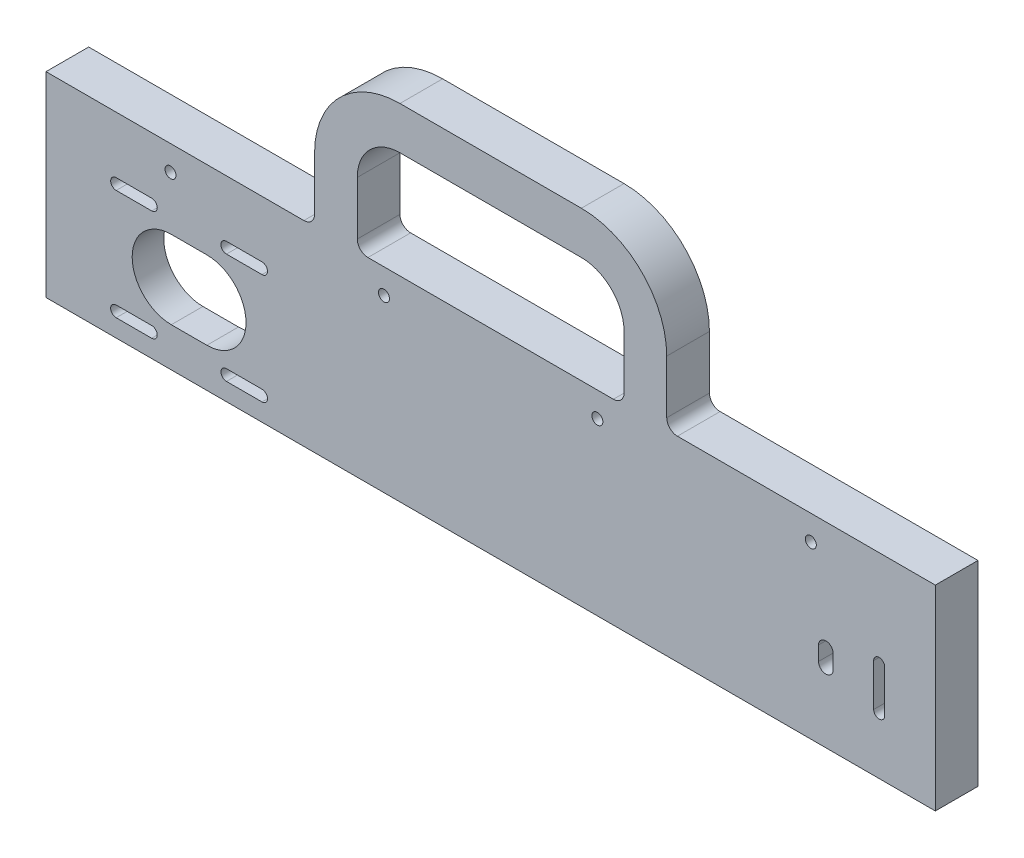
from build123d import *

# Parameters (mm, degrees)
SKIZZE2_R                       = 1.55
SKIZZE2_W                       = 75
SKIZZE2_H                       = 30
AUFSATZ_LINEAR_AUSTRAGEN1_DEPTH = 12
SKIZZE2_3_W                     = 52
SKIZZE2_3_H                     = 43
SCHNITT_LINEAR_AUSTRAGEN1_DEPTH = 3.11
VERRUNDUNG1_R                   = 12
VERRUNDUNG2_R                   = 24
VERRUNDUNG3_R                   = 3
VERRUNDUNG4_R                   = 3


with BuildPart() as part:
    # Skizze2 → Aufsatz-Linear austragen1 (new body)
    with BuildSketch(Plane.XY):
        Polygon((-125, 27.5), (-125, -27.5), (125, -27.5), (125, 27.5), (49.5, 27.5), (49.5, 69.5), (-49.5, 69.5), (-49.5, 27.5), align=None)
        with Locations((-90, 20.5)):
            Circle(SKIZZE2_R, mode=Mode.SUBTRACT)
        with Locations((-30, 20.5)):
            Circle(SKIZZE2_R, mode=Mode.SUBTRACT)
        with BuildLine():
            ThreePointArc((92.175, -3.5), (94.225, -1.45), (96.275, -3.5))
            Line((96.275, -3.5), (96.275, -7.5))
            ThreePointArc((96.275, -7.5), (94.225, -9.55), (92.175, -7.5))
            Line((92.175, -7.5), (92.175, -3.5))
        make_face(mode=Mode.SUBTRACT)
        with BuildLine():
            ThreePointArc((107.675, 0.45), (109.225, 2), (110.775, 0.45))
            Line((110.775, 0.45), (110.775, -11.45))
            ThreePointArc((110.775, -11.45), (109.225, -13), (107.675, -11.45))
            Line((107.675, -11.45), (107.675, 0.45))
        make_face(mode=Mode.SUBTRACT)
        with Locations((30, 20.5)):
            Circle(SKIZZE2_R, mode=Mode.SUBTRACT)
        with Locations((90, 20.5)):
            Circle(SKIZZE2_R, mode=Mode.SUBTRACT)
        with Locations((0, 42.5)):
            Rectangle(SKIZZE2_W, SKIZZE2_H, mode=Mode.SUBTRACT)
        with BuildLine():
            Line((-74.275, 11.55), (-64.275, 11.55))
            ThreePointArc((-64.275, 11.55), (-62.725, 10), (-64.275, 8.45))
            Line((-64.275, 8.45), (-74.275, 8.45))
            ThreePointArc((-74.275, 8.45), (-75.825, 10), (-74.275, 11.55))
        make_face(mode=Mode.SUBTRACT)
        with BuildLine():
            ThreePointArc((-105.275, -22.55), (-106.825, -21), (-105.275, -19.45))
            Line((-105.275, -19.45), (-95.275, -19.45))
            ThreePointArc((-95.275, -19.45), (-93.725, -21), (-95.275, -22.55))
            Line((-95.275, -22.55), (-105.275, -22.55))
        make_face(mode=Mode.SUBTRACT)
        with BuildLine():
            ThreePointArc((-64.275, -19.45), (-62.725, -21), (-64.275, -22.55))
            Line((-64.275, -22.55), (-74.275, -22.55))
            ThreePointArc((-74.275, -22.55), (-75.825, -21), (-74.275, -19.45))
            Line((-74.275, -19.45), (-64.275, -19.45))
        make_face(mode=Mode.SUBTRACT)
        with BuildLine():
            ThreePointArc((-79.775, 5.5), (-68.775, -5.5), (-79.775, -16.5))
            Line((-79.775, -16.5), (-89.775, -16.5))
            ThreePointArc((-89.775, -16.5), (-100.775, -5.5), (-89.775, 5.5))
            Line((-89.775, 5.5), (-79.775, 5.5))
        make_face(mode=Mode.SUBTRACT)
        with BuildLine():
            ThreePointArc((-105.275, 8.45), (-106.825, 10), (-105.275, 11.55))
            Line((-105.275, 11.55), (-95.275, 11.55))
            ThreePointArc((-95.275, 11.55), (-93.725, 10), (-95.275, 8.45))
            Line((-95.275, 8.45), (-105.275, 8.45))
        make_face(mode=Mode.SUBTRACT)
    extrude(amount=AUFSATZ_LINEAR_AUSTRAGEN1_DEPTH)

    # Skizze2<3> → Schnitt-Linear austragen1 (cut)
    with BuildSketch(Plane.XY):
        with Locations((-84.775, -6)):
            Rectangle(SKIZZE2_3_W, SKIZZE2_3_H)
        with BuildLine():
            ThreePointArc((-105.275, -22.55), (-106.825, -21), (-105.275, -19.45))
            Line((-105.275, -19.45), (-95.275, -19.45))
            ThreePointArc((-95.275, -19.45), (-93.725, -21), (-95.275, -22.55))
            Line((-95.275, -22.55), (-105.275, -22.55))
        make_face(mode=Mode.SUBTRACT)
        with BuildLine():
            ThreePointArc((-64.275, -19.45), (-62.725, -21), (-64.275, -22.55))
            Line((-64.275, -22.55), (-74.275, -22.55))
            ThreePointArc((-74.275, -22.55), (-75.825, -21), (-74.275, -19.45))
            Line((-74.275, -19.45), (-64.275, -19.45))
        make_face(mode=Mode.SUBTRACT)
        with BuildLine():
            ThreePointArc((-79.775, 5.5), (-68.775, -5.5), (-79.775, -16.5))
            Line((-79.775, -16.5), (-89.775, -16.5))
            ThreePointArc((-89.775, -16.5), (-100.775, -5.5), (-89.775, 5.5))
            Line((-89.775, 5.5), (-79.775, 5.5))
        make_face(mode=Mode.SUBTRACT)
        with BuildLine():
            ThreePointArc((-105.275, 8.45), (-106.825, 10), (-105.275, 11.55))
            Line((-105.275, 11.55), (-95.275, 11.55))
            ThreePointArc((-95.275, 11.55), (-93.725, 10), (-95.275, 8.45))
            Line((-95.275, 8.45), (-105.275, 8.45))
        make_face(mode=Mode.SUBTRACT)
        with BuildLine():
            ThreePointArc((-64.275, 11.55), (-62.725, 10), (-64.275, 8.45))
            Line((-64.275, 8.45), (-74.275, 8.45))
            ThreePointArc((-74.275, 8.45), (-75.825, 10), (-74.275, 11.55))
            Line((-74.275, 11.55), (-64.275, 11.55))
        make_face(mode=Mode.SUBTRACT)
    extrude(amount=SCHNITT_LINEAR_AUSTRAGEN1_DEPTH, mode=Mode.SUBTRACT)

    # Verrundung1
    verrundung1_edges = [part.edges().sort_by_distance(p)[0] for p in [
        (37.5, 57.5, 6),
        (-37.5, 57.5, 6),
    ]]
    fillet(verrundung1_edges, radius=VERRUNDUNG1_R)

    # Verrundung2
    verrundung2_edges = [part.edges().sort_by_distance(p)[0] for p in [
        (49.5, 69.5, 6),
        (-49.5, 69.5, 6),
    ]]
    fillet(verrundung2_edges, radius=VERRUNDUNG2_R)

    # Verrundung3
    verrundung3_edges = [part.edges().sort_by_distance(p)[0] for p in [
        (49.5, 27.5, 6),
        (-37.5, 27.5, 6),
        (37.5, 27.5, 6),
        (-49.5, 27.5, 6),
    ]]
    fillet(verrundung3_edges, radius=VERRUNDUNG3_R)

    # Verrundung4
    verrundung4_edges = [part.edges().sort_by_distance(p)[0] for p in [
        (-110.775, 15.5, 1.555),
        (-58.775, 15.5, 1.555),
    ]]
    fillet(verrundung4_edges, radius=VERRUNDUNG4_R)


solid = part.part
